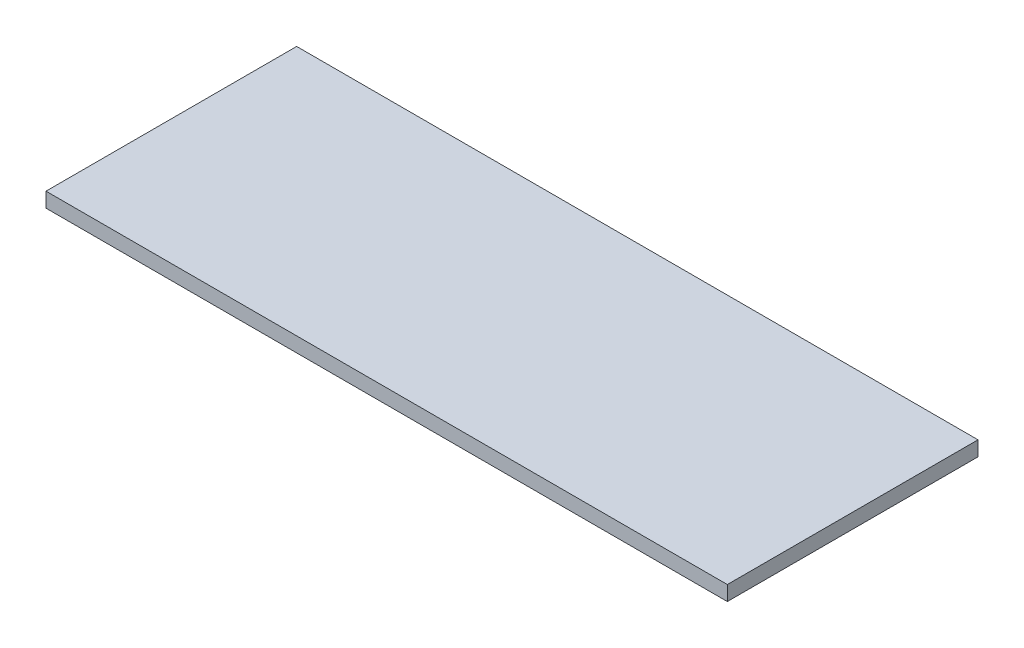
from build123d import *

# Parameters (mm, degrees)
SKETCH_1_W      = 369.1889154
SKETCH_1_H      = 135.824952
EXTRUDE_1_DEPTH = 8
SKETCH_3_W      = 18
SKETCH_3_H      = 51
EXTRUDE_3_DEPTH = 4


with BuildPart() as part:
    # 草图1 → 凸台-拉伸1 (new body)
    with BuildSketch(Plane(origin=(0, 0, 0), x_dir=(1, 0, 0), z_dir=(0, 1, 0))):
        with Locations((183.6895423, 67.047524)):
            Rectangle(SKETCH_1_W, SKETCH_1_H)
    extrude(amount=EXTRUDE_1_DEPTH)

    # 草图3 → 凸台-拉伸3 (add)
    with BuildSketch(Plane.XZ):
        with Locations((73.0950846, -47.635048)):
            Rectangle(SKETCH_3_W, SKETCH_3_H)
    extrude(amount=EXTRUDE_3_DEPTH)


solid = part.part
